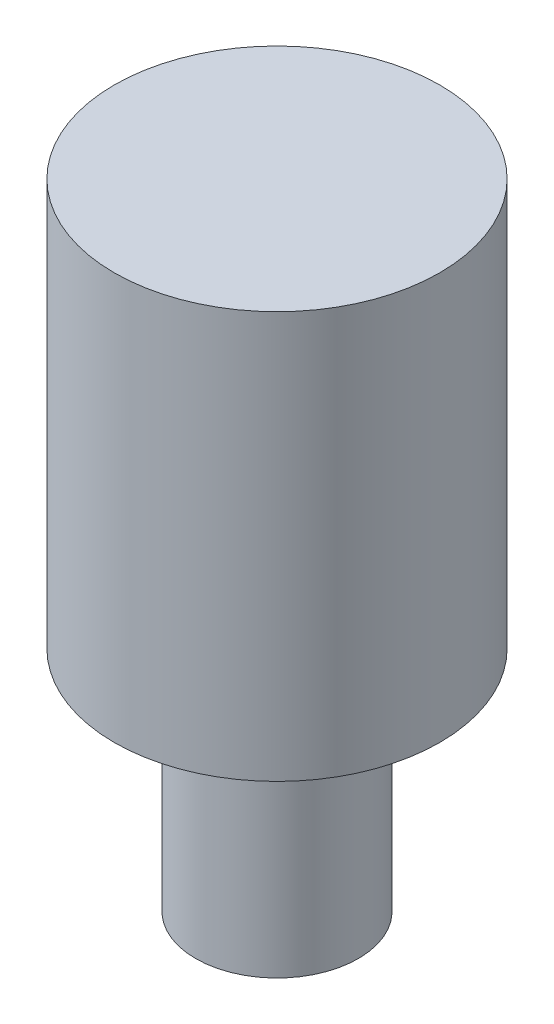
from build123d import *

# Parameters (mm, degrees)
SKETCH_1_R      = 1
EXTRUDE_1_DEPTH = 2.8
SKETCH_2_R      = 2
EXTRUDE_2_DEPTH = 5


with BuildPart() as part:
    # 草圖1 → 填料-伸長1 (new body)
    with BuildSketch(Plane(origin=(0, 0, 0), x_dir=(1, 0, 0), z_dir=(0, 1, 0))):
        with Locations(Location((0, 0, 0), (0, 0, 270))):
            Circle(SKETCH_1_R)
    extrude(amount=EXTRUDE_1_DEPTH)

    # 草圖2 → 填料-伸長2 (add)
    with BuildSketch(Plane(origin=(0, 2.8, 0), x_dir=(1, 0, 0), z_dir=(0, 1, 0))):
        with Locations(Location((0, 0, 0), (0, 0, 270))):
            Circle(SKETCH_2_R)
    extrude(amount=EXTRUDE_2_DEPTH)


solid = part.part
